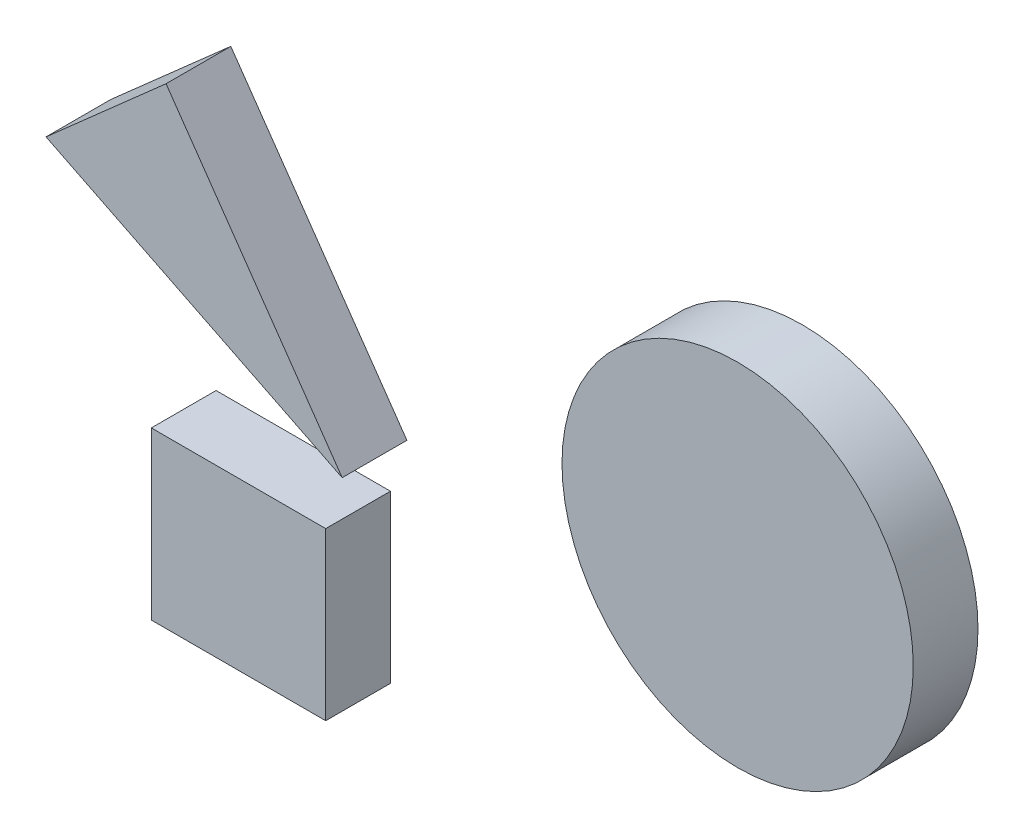
from build123d import *

# Parameters (mm, degrees)
SKETCH1_R           = 27.12492427
BOSS_EXTRUDE1_DEPTH = 10
SKETCH2_W           = 26.93082218
SKETCH2_H           = 25.702398712
BOSS_EXTRUDE2_DEPTH = 10
BOSS_EXTRUDE3_DEPTH = 10


with BuildPart() as part:
    # Sketch1 → Boss-Extrude1 (new body)
    with BuildSketch(Plane.XY):
        with Locations((34.312919793, 34.457095292)):
            Circle(SKETCH1_R)
    extrude(amount=BOSS_EXTRUDE1_DEPTH)


with BuildPart() as body_2:
    # Sketch2 → Boss-Extrude2 (new body)
    with BuildSketch(Plane.XY.offset(10)):
        with Locations((-32.770372386, 4.658042558)):
            Rectangle(SKETCH2_W, SKETCH2_H)
    extrude(amount=BOSS_EXTRUDE2_DEPTH)


with BuildPart() as body_3:
    # Sketch3 → Boss-Extrude3 (new body)
    with BuildSketch(Plane.XY.offset(10)):
        Polygon((-43.960387264, 64.682988273), (-62.503954018, 48.302837641), (-16.763156025, 25.586968367), align=None)
    extrude(amount=BOSS_EXTRUDE3_DEPTH)


solid = Compound([part.part, body_2.part, body_3.part])
